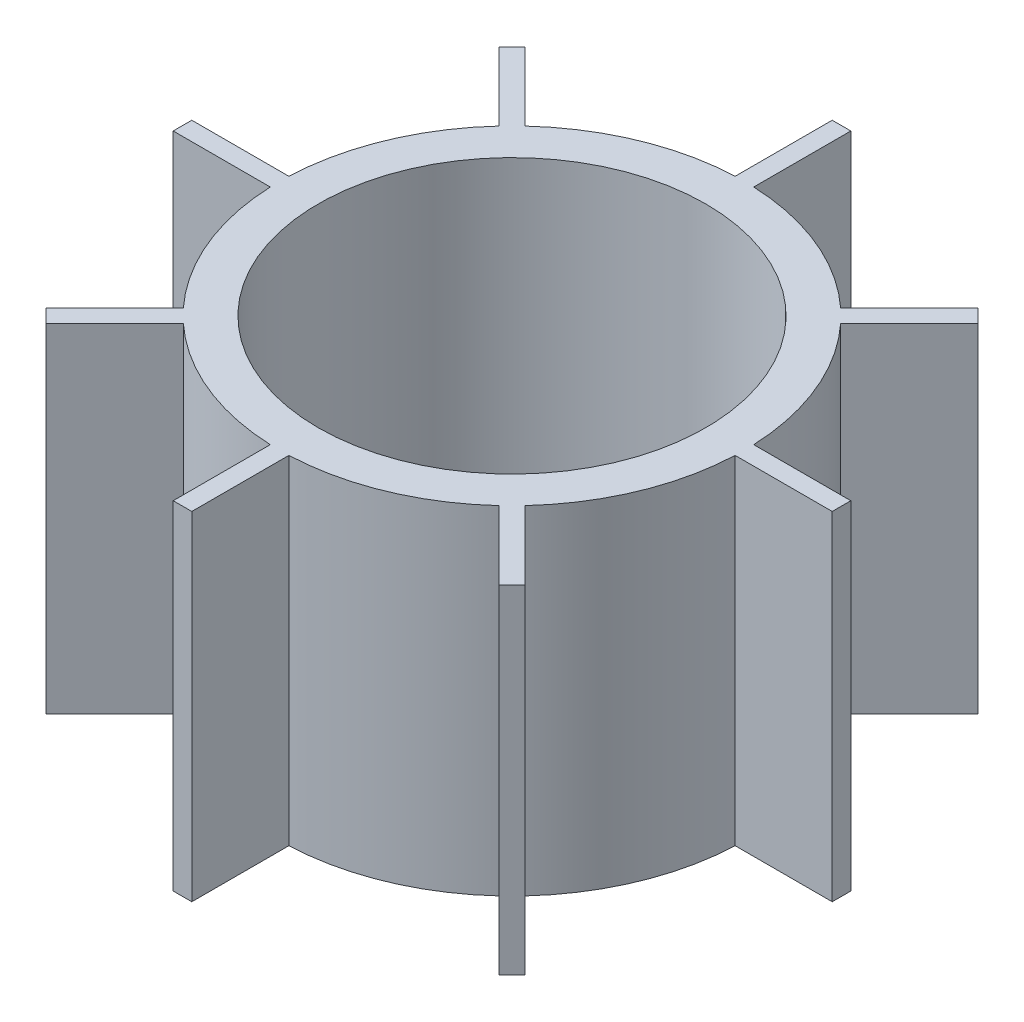
from build123d import *

# Parameters (mm, degrees)
SKETCH1_R                = 38.1
SKETCH1_R_2              = 31.75
BOSS_EXTRUDE1_DEPTH      = 55.372
BOSS_EXTRUDE2_REACH      = 115.998
BOSS_EXTRUDE2_END_RADIUS = 38.1
SKETCH2_W                = 3.048
SKETCH2_H                = 55.372
CIRPATTERN1_COUNT        = 8


with BuildPart() as part:
    # Sketch1 → Boss-Extrude1 (new body)
    with BuildSketch(Plane(origin=(0, 0, 0), x_dir=(1, 0, 0), z_dir=(0, 1, 0))):
        with Locations(Location((0, 0, 0), (0, 0, 270))):
            Circle(SKETCH1_R)
        with Locations(Location((0, 0, 0), (0, 0, 270))):
            Circle(SKETCH1_R_2, mode=Mode.SUBTRACT)
    extrude(amount=BOSS_EXTRUDE1_DEPTH)

    # Boss-Extrude2: up to this cylinder (the profile starts outside it)
    boss_extrude2_end = Plane(origin=(0, 27.686, 0), z_dir=(0, -1, 0)) * Cylinder(BOSS_EXTRUDE2_END_RADIUS, 309.196, mode=Mode.PRIVATE)
    # Sketch2 → Boss-Extrude2 (add, up to the surface)
    with BuildSketch(Plane.XY.offset(53.975), mode=Mode.PRIVATE) as boss_extrude2_sk1:
        with Locations((0, 27.686)):
            Rectangle(SKETCH2_W, SKETCH2_H)
    boss_extrude2_tool1 = extrude(boss_extrude2_sk1.sketch, amount=-BOSS_EXTRUDE2_REACH, mode=Mode.PRIVATE) - boss_extrude2_end
    boss_extrude2 = boss_extrude2_tool1.solids().sort_by_distance((0, 27.686, 53.975))[0]
    add(boss_extrude2)

    # CirPattern1: Boss-Extrude2 ×8 about axis
    cirpattern1_axis = Axis((0, 0, 0), (0, 1, 0))
    for i in range(1, CIRPATTERN1_COUNT):
        add(boss_extrude2.rotate(cirpattern1_axis, i * 360 / CIRPATTERN1_COUNT))


solid = part.part
